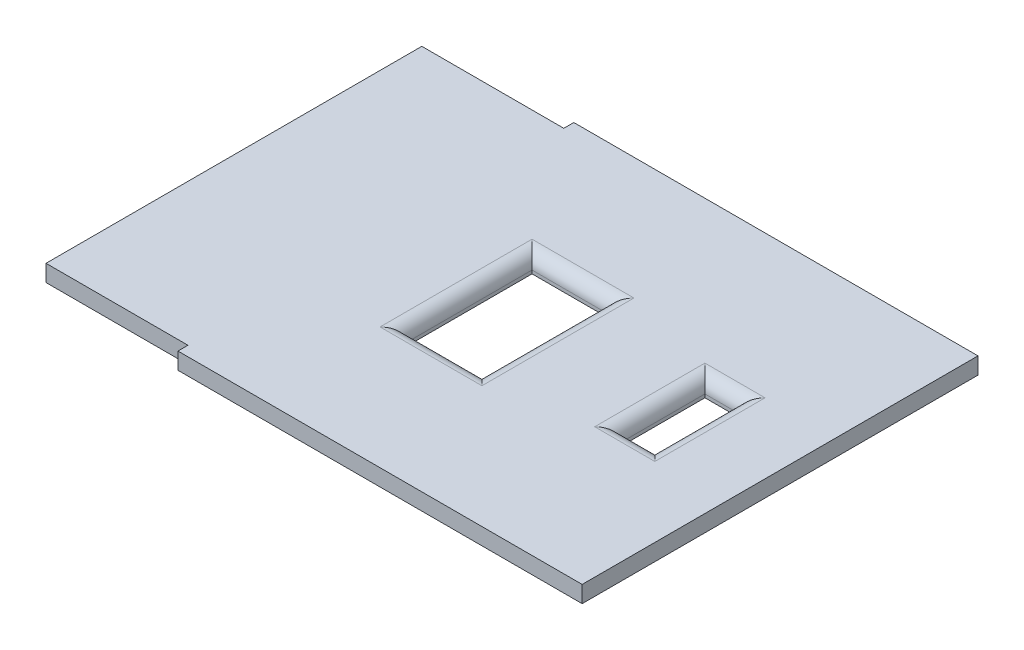
from build123d import *

# Parameters (mm, degrees)
BOSS_EXTRUDE1_DEPTH = 2.54
SKETCH2_W           = 11.43
SKETCH2_H           = 19.05
SKETCH2_W_2         = 5.08
SKETCH2_H_2         = 12.7
CUT_EXTRUDE1_DEPTH  = 89.380047324
FILLET1_R           = 2.032


with BuildPart() as part:
    # Sketch1 → Boss-Extrude1 (new body)
    with BuildSketch(Plane(origin=(0, 0, 0), x_dir=(1, 0, 0), z_dir=(0, 1, 0))):
        Polygon((0, 28.575), (0, -28.575), (21.59, -28.575), (21.59, -30.099), (83.058, -30.099), (83.058, 30.099), (21.59, 30.099), (21.59, 28.575), align=None)
    extrude(amount=BOSS_EXTRUDE1_DEPTH)

    # Sketch2 → Cut-Extrude1 (cut, through all)
    with BuildSketch(Plane(origin=(0, 2.54, 0), x_dir=(1, 0, 0), z_dir=(0, 1, 0))):
        with Locations((41.529, 0)):
            Rectangle(SKETCH2_W, SKETCH2_H)
        with Locations((67.818, 0)):
            Rectangle(SKETCH2_W_2, SKETCH2_H_2)
    extrude(amount=-CUT_EXTRUDE1_DEPTH, mode=Mode.SUBTRACT)

    # Fillet1
    fillet1_edges = [part.edges().sort_by_distance(p)[0] for p in [
        (47.244, 2.54, 0),
        (41.529, 2.54, -9.525),
        (35.814, 2.54, 0),
        (41.529, 2.54, 9.525),
        (70.358, 2.54, 0),
        (67.818, 2.54, -6.35),
        (65.278, 2.54, 0),
        (67.818, 2.54, 6.35),
    ]]
    fillet(fillet1_edges, radius=FILLET1_R)


solid = part.part
